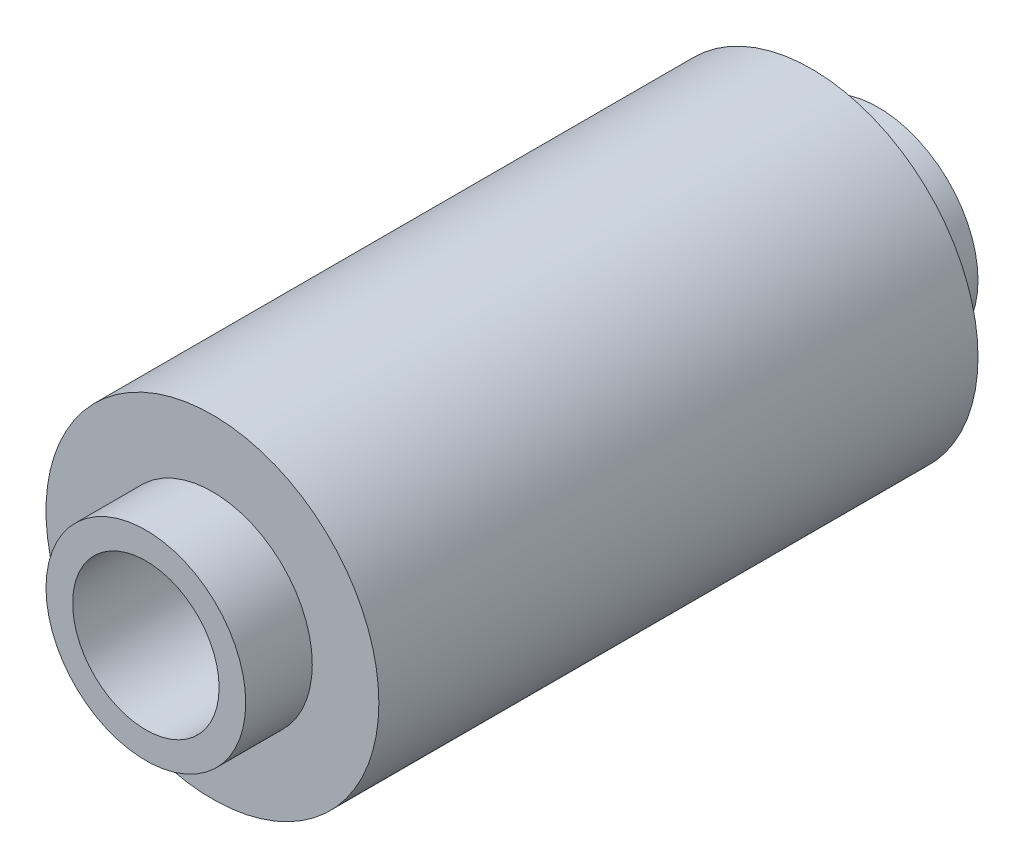
from build123d import *

# Parameters (mm, degrees)
SKETCH1_R                   = 2.5
SKETCH1_R_2                 = 1.1
SHOULDER_SPACER_L9_DEPTH    = 9
LOWER_TORQUE_PILOT_D3_START = -1
SKETCH2_R                   = 1.5
SKETCH2_R_2                 = 1.1
LOWER_TORQUE_PILOT_D3_DEPTH = 1
UPPER_TORQUE_PILOT_D3_START = 9
SKETCH3_R                   = 1.5
SKETCH3_R_2                 = 1.1
UPPER_TORQUE_PILOT_D3_DEPTH = 1


with BuildPart() as part:
    # Sketch1 → Shoulder_Spacer_L9 (new body)
    with BuildSketch(Plane.XY):
        Circle(SKETCH1_R)
        Circle(SKETCH1_R_2, mode=Mode.SUBTRACT)
    extrude(amount=SHOULDER_SPACER_L9_DEPTH)

    # Sketch2 → Lower_Torque_Pilot_D3 (add)
    with BuildSketch(Plane.XY.offset(LOWER_TORQUE_PILOT_D3_START)):
        Circle(SKETCH2_R)
        Circle(SKETCH2_R_2, mode=Mode.SUBTRACT)
    extrude(amount=LOWER_TORQUE_PILOT_D3_DEPTH)

    # Sketch3 → Upper_Torque_Pilot_D3 (add)
    with BuildSketch(Plane.XY.offset(UPPER_TORQUE_PILOT_D3_START)):
        Circle(SKETCH3_R)
        Circle(SKETCH3_R_2, mode=Mode.SUBTRACT)
    extrude(amount=UPPER_TORQUE_PILOT_D3_DEPTH)


solid = part.part
